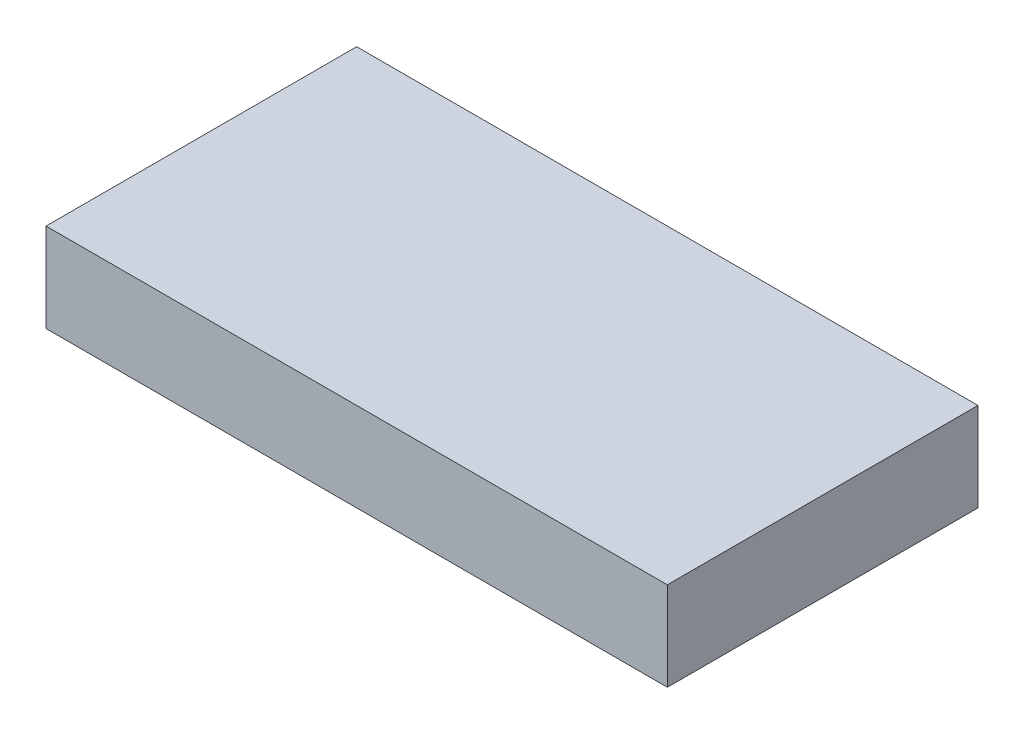
from build123d import *

# Parameters (mm, degrees)
SKETCH1_W           = 177.8
SKETCH1_H           = 88.9
BOSS_EXTRUDE1_DEPTH = 25.4


with BuildPart() as part:
    # Sketch1 → Boss-Extrude1 (new body)
    with BuildSketch(Plane(origin=(0, 0, 0), x_dir=(1, 0, 0), z_dir=(0, 1, 0))):
        Rectangle(SKETCH1_W, SKETCH1_H)
    extrude(amount=BOSS_EXTRUDE1_DEPTH)


solid = part.part
